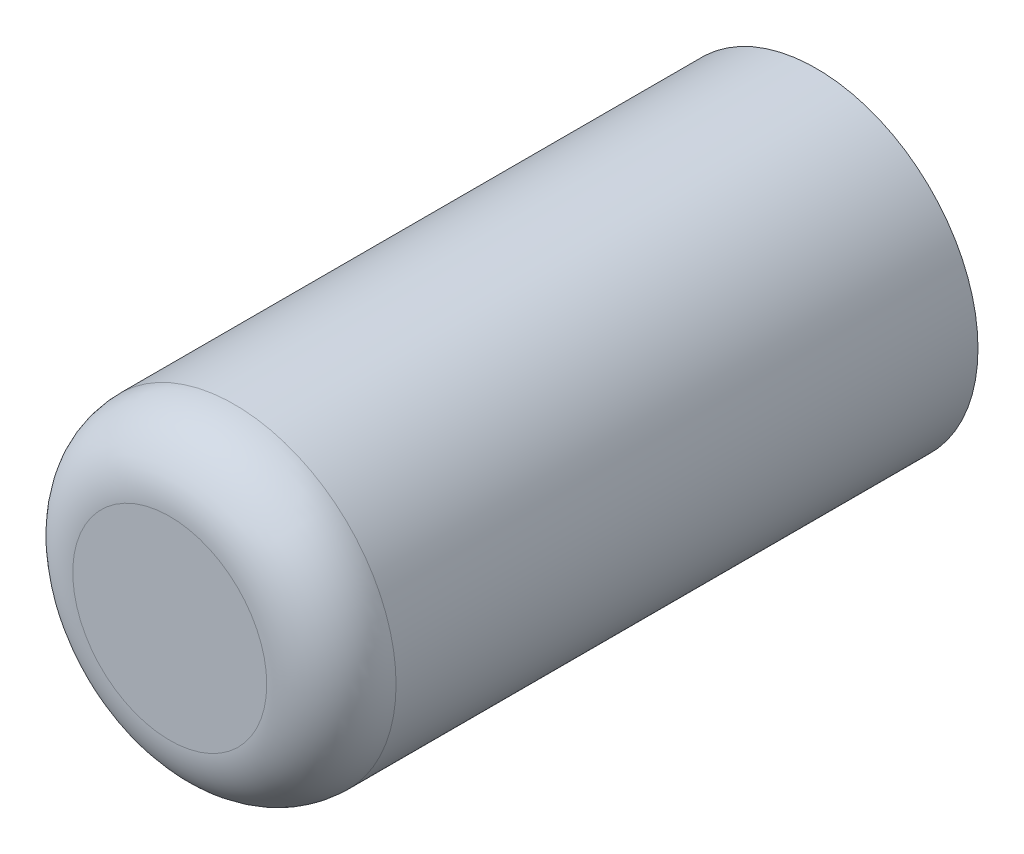
from build123d import *

# Parameters (mm, degrees)
SKETCH_1_R      = 25
EXTRUDE_1_DEPTH = 100
FILLET_1_R      = 10


with BuildPart() as part:
    # Эскиз1 → Бобышка-Вытянуть1 (new body)
    with BuildSketch(Plane.XY):
        Circle(SKETCH_1_R)
    extrude(amount=EXTRUDE_1_DEPTH)

    # Скругление1
    fillet_1_edges = [part.edges().sort_by_distance(p)[0] for p in [
        (-25, 0, 100),
    ]]
    fillet(fillet_1_edges, radius=FILLET_1_R)


solid = part.part
